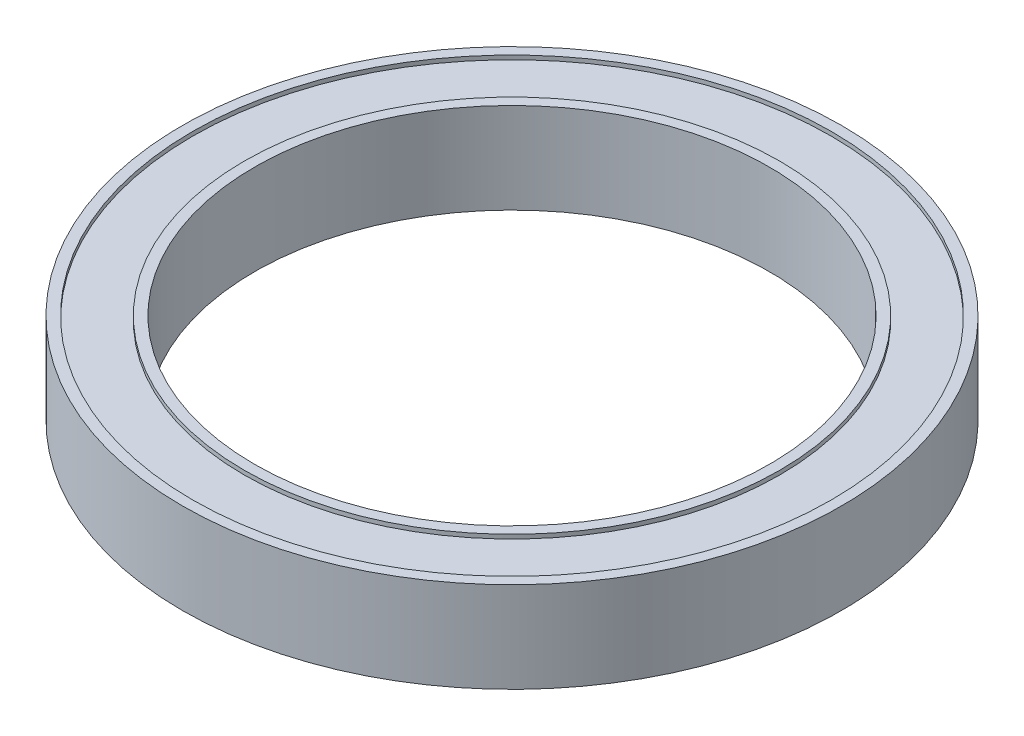
from build123d import *

# Parameters (mm, degrees)
SKETCH1_R                = 16
SKETCH1_R_2              = 12.5
BOSS_EXTRUDE1_DEPTH      = 4
BOSS_EXTRUDE2_DEPTH      = 0.2
BOSS_EXTRUDE2_DEPTH_BACK = 4.2
SKETCH2_R                = 16
SKETCH2_R_2              = 15.5
SKETCH2_R_3              = 13
SKETCH2_R_4              = 12.5


with BuildPart() as part:
    # Sketch1 → Boss-Extrude1 (new body)
    with BuildSketch(Plane(origin=(0, 0, 0), x_dir=(1, 0, 0), z_dir=(0, 1, 0))):
        with Locations(Location((0, 0, 0), (0, 0, 270))):
            Circle(SKETCH1_R)
        with Locations(Location((0, 0, 0), (0, 0, 270))):
            Circle(SKETCH1_R_2, mode=Mode.SUBTRACT)
    extrude(amount=BOSS_EXTRUDE1_DEPTH)

    # Sketch2 → Boss-Extrude2 (add, two sides: drawn at the far end of the back side and taken through both)
    # profile 1 of 2: a face of its own
    with BuildSketch(Plane(origin=(0, 4, 0), x_dir=(1, 0, 0), z_dir=(0, 1, 0)).offset(-BOSS_EXTRUDE2_DEPTH_BACK)):
        with Locations(Location((0, 0, 0), (0, 0, 270))):
            Circle(SKETCH2_R)
        with Locations(Location((0, 0, 0), (0, 0, 270))):
            Circle(SKETCH2_R_2, mode=Mode.SUBTRACT)
    # profile 2 of 2: a face of its own
    with BuildSketch(Plane(origin=(0, 4, 0), x_dir=(1, 0, 0), z_dir=(0, 1, 0)).offset(-BOSS_EXTRUDE2_DEPTH_BACK)):
        with Locations(Location((0, 0, 0), (0, 0, 270))):
            Circle(SKETCH2_R_3)
        with Locations(Location((0, 0, 0), (0, 0, 270))):
            Circle(SKETCH2_R_4, mode=Mode.SUBTRACT)
    extrude(amount=BOSS_EXTRUDE2_DEPTH + BOSS_EXTRUDE2_DEPTH_BACK)


solid = part.part
